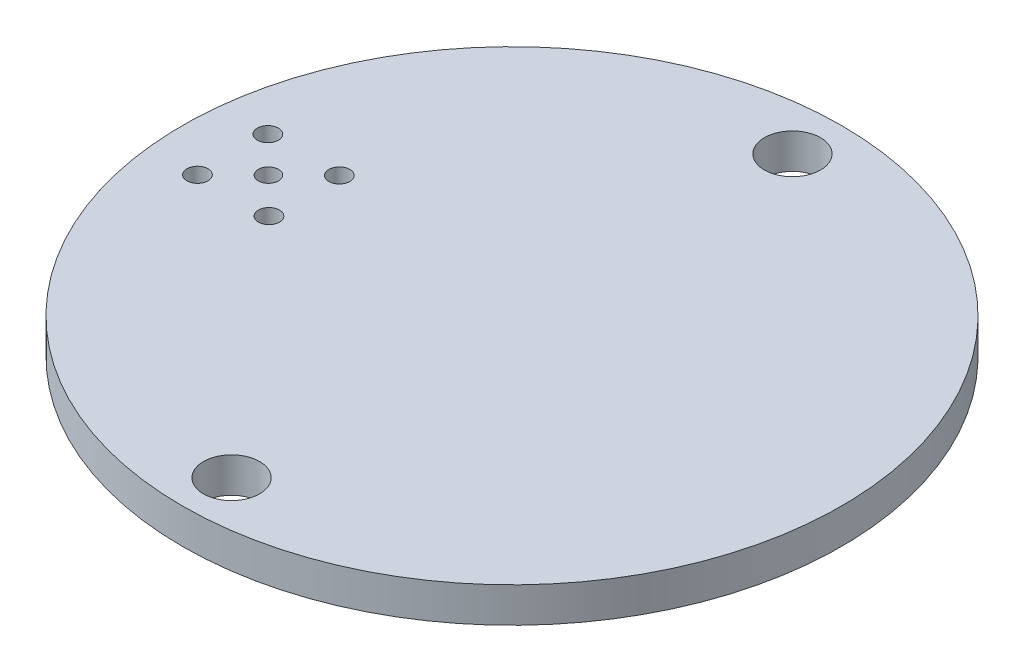
from build123d import *

# Parameters (mm, degrees)
ESBO_O1_R                = 23.5
ESBO_O1_R_2              = 2
ESBO_O1_R_3              = 0.75
ESBO_O1_R_4              = 0.718777801
RESSALTO_EXTRUS_O1_DEPTH = 2.5


with BuildPart() as part:
    # Esboço1 → Ressalto-extrusão1 (new body)
    with BuildSketch(Plane(origin=(0, 0, 0), x_dir=(1, 0, 0), z_dir=(0, 1, 0))):
        with Locations(Location((0, 0, 0), (0, 0, 270))):
            Circle(ESBO_O1_R)
        with Locations(Location((0, -20, 0), (0, 0, 270))):
            Circle(ESBO_O1_R_2, mode=Mode.SUBTRACT)
        with Locations(Location((0, 20, 0), (0, 0, 90))):
            Circle(ESBO_O1_R_2, mode=Mode.SUBTRACT)
        with Locations(Location((-19.920215214, 2.51, 0), (0, 0, 270))):
            Circle(ESBO_O1_R_3, mode=Mode.SUBTRACT)
        with Locations(Location((-14.820215214, 2.51, 0), (0, 0, 270))):
            Circle(ESBO_O1_R_3, mode=Mode.SUBTRACT)
        with Locations(Location((-14.820215214, -2.51, 0), (0, 0, 90))):
            Circle(ESBO_O1_R_3, mode=Mode.SUBTRACT)
        with Locations(Location((-19.920215214, -2.51, 0), (0, 0, 90))):
            Circle(ESBO_O1_R_3, mode=Mode.SUBTRACT)
        with Locations(Location((-17.370215214, 0, 0), (0, 0, 270))):
            Circle(ESBO_O1_R_4, mode=Mode.SUBTRACT)
    extrude(amount=RESSALTO_EXTRUS_O1_DEPTH)


solid = part.part
